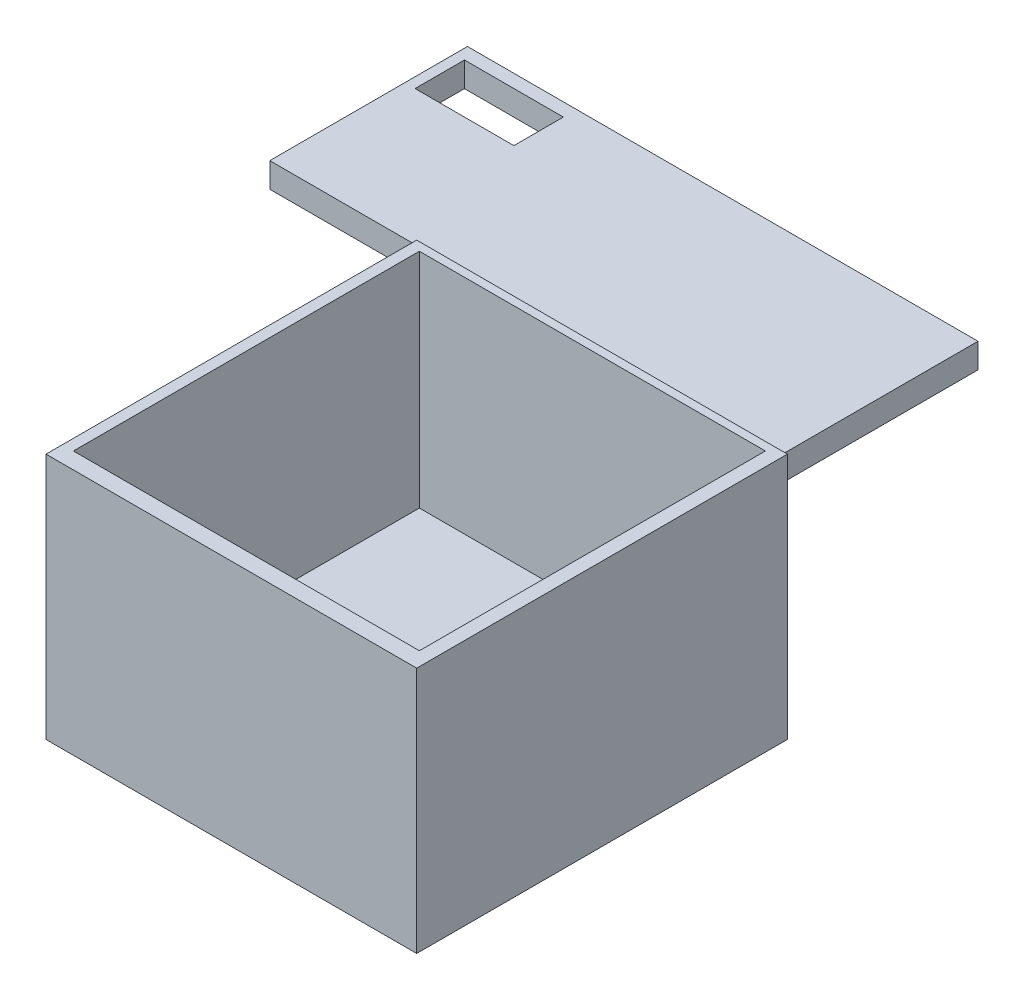
from build123d import *

# Parameters (mm, degrees)
SKETCH_1_W          = 150
SKETCH_1_H          = 150
EXTRUDE_1_DEPTH     = 100
SKETCH_2_W          = 140
SKETCH_2_H          = 140
CUT_EXTRUDE_1_DEPTH = 90
SKETCH_3_W          = 206.584523794
SKETCH_3_H          = 10.04468641
EXTRUDE_2_DEPTH     = 80
SKETCH_4_W          = 40
SKETCH_4_H          = 20
CUT_EXTRUDE_2_DEPTH = 20


with BuildPart() as part:
    # 草图1 → 凸台-拉伸1 (new body)
    with BuildSketch(Plane(origin=(0, 0, 0), x_dir=(1, 0, 0), z_dir=(0, 1, 0))):
        with Locations((-61.989619377, -68.944636678)):
            Rectangle(SKETCH_1_W, SKETCH_1_H)
    extrude(amount=EXTRUDE_1_DEPTH)

    # 草图2 → 切除-拉伸1 (cut)
    with BuildSketch(Plane(origin=(0, 100, 0), x_dir=(1, 0, 0), z_dir=(0, 1, 0))):
        with Locations((-62.547413878, -67.29555388)):
            Rectangle(SKETCH_2_W, SKETCH_2_H)
    extrude(amount=-CUT_EXTRUDE_1_DEPTH, mode=Mode.SUBTRACT)

    # 草图3 → 凸台-拉伸2 (add)
    with BuildSketch(Plane(origin=(0, 0, -6.055363322), x_dir=(-1, 0, 0), z_dir=(0, 0, -1))):
        with Locations((93.150620362, 93.10231994)):
            Rectangle(SKETCH_3_W, SKETCH_3_H)
    extrude(amount=EXTRUDE_2_DEPTH)

    # 草图4 → 切除-拉伸2 (cut)
    with BuildSketch(Plane.XZ.offset(-88.079976735)):
        with Locations((-172.313011016, -70.712776271)):
            Rectangle(SKETCH_4_W, SKETCH_4_H)
    extrude(amount=-CUT_EXTRUDE_2_DEPTH, mode=Mode.SUBTRACT)


solid = part.part
